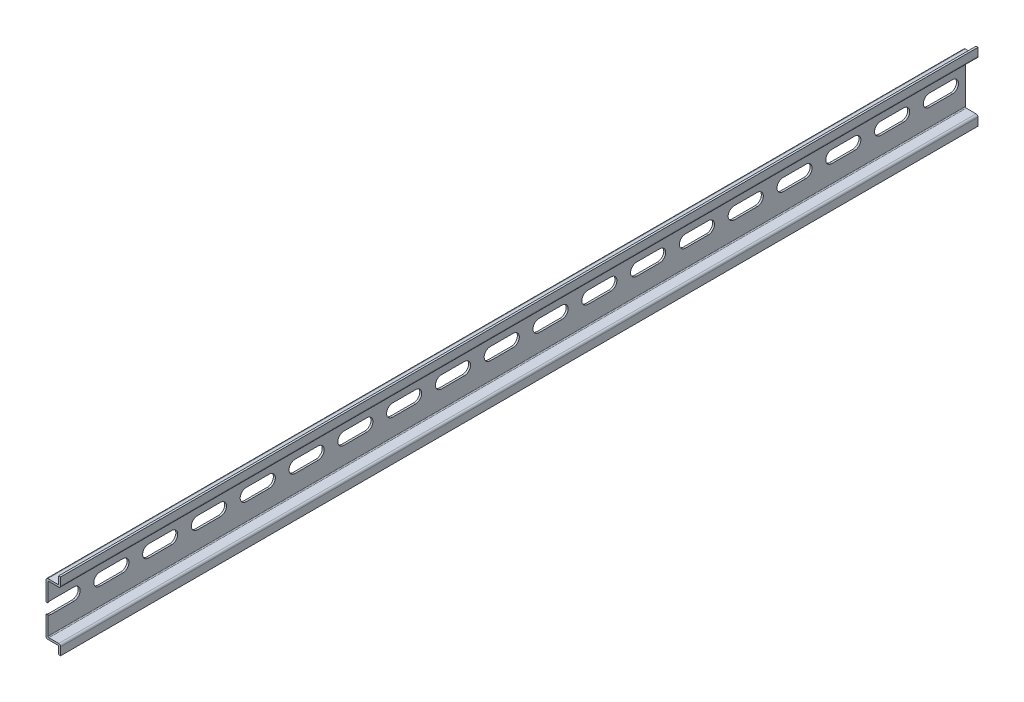
from build123d import *

# Parameters (mm, degrees)
BOSS_EXTRUDE1_DEPTH = 500
CUT_EXTRUDE1_DEPTH  = 7.5
LPATTERN1_COUNT     = 40
LPATTERN1_PITCH     = 25
SKETCH3_W           = 59.422885842
SKETCH3_H           = 88.158569076
CUT_EXTRUDE2_DEPTH  = 530


with BuildPart() as part:
    # Sketch1 → Boss-Extrude1 (new, symmetric)
    with BuildSketch(Plane.XY):
        with BuildLine():
            Line((7.5, 17.5), (6.5, 17.5))
            Line((6.5, 17.5), (6.5, 14))
            ThreePointArc((6.5, 14), (6.353553391, 13.646446609), (6, 13.5))
            Line((6, 13.5), (1, 13.5))
            ThreePointArc((1, 13.5), (0.292893219, 13.207106781), (0, 12.5))
            Line((0, 12.5), (0, -12.5))
            ThreePointArc((0, -12.5), (0.292893219, -13.207106781), (1, -13.5))
            Line((1, -13.5), (6, -13.5))
            ThreePointArc((6, -13.5), (6.353553391, -13.646446609), (6.5, -14))
            Line((6.5, -14), (6.5, -17.5))
            Line((6.5, -17.5), (7.5, -17.5))
            Line((7.5, -17.5), (7.5, -13.5))
            ThreePointArc((7.5, -13.5), (7.207106781, -12.792893219), (6.5, -12.5))
            Line((6.5, -12.5), (1.5, -12.5))
            ThreePointArc((1.5, -12.5), (1.146446609, -12.353553391), (1, -12))
            Line((1, -12), (1, 12))
            ThreePointArc((1, 12), (1.146446609, 12.353553391), (1.5, 12.5))
            Line((1.5, 12.5), (6.5, 12.5))
            ThreePointArc((6.5, 12.5), (7.207106781, 12.792893219), (7.5, 13.5))
            Line((7.5, 13.5), (7.5, 17.5))
        make_face()
    extrude(amount=BOSS_EXTRUDE1_DEPTH, both=True)

    # Sketch2 → Cut-Extrude1 (cut)
    with BuildSketch(Plane(origin=(0, 0, 0), x_dir=(0, 0, -1), z_dir=(1, 0, 0))):
        with BuildLine():
            Line((-493.35, 3.15), (-481.65, 3.15))
            ThreePointArc((-481.65, 3.15), (-478.5, 0), (-481.65, -3.15))
            Line((-481.65, -3.15), (-493.35, -3.15))
            ThreePointArc((-493.35, -3.15), (-496.5, 0), (-493.35, 3.15))
        make_face()
    cut_extrude1 = extrude(amount=CUT_EXTRUDE1_DEPTH, mode=Mode.SUBTRACT)

    # LPattern1: Cut-Extrude1 ×40
    with Locations(*[(0, 0, -i * LPATTERN1_PITCH) for i in range(1, LPATTERN1_COUNT)]):
        add(cut_extrude1, mode=Mode.SUBTRACT)

    # Sketch3 → Cut-Extrude2 (cut)
    with BuildSketch(Plane.XY.offset(500)):
        Rectangle(SKETCH3_W, SKETCH3_H)
    extrude(amount=-CUT_EXTRUDE2_DEPTH, mode=Mode.SUBTRACT)


solid = part.part
